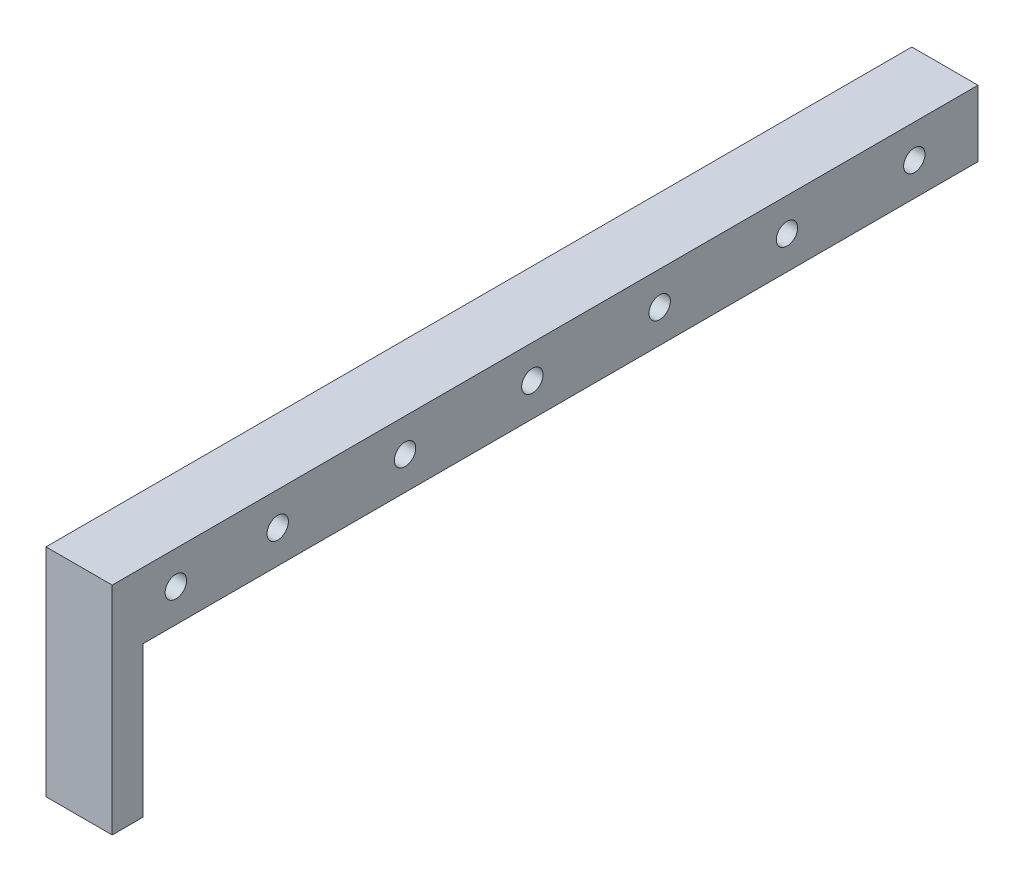
from build123d import *

# Parameters (mm, degrees)
SKETCH1_W           = 13
SKETCH1_H           = 13
BOSS_EXTRUDE1_DEPTH = 85
SKETCH2_W           = 13
SKETCH2_H           = 30.5
BOSS_EXTRUDE2_DEPTH = 3
SKETCH3_R           = 2.1
CUT_EXTRUDE1_DEPTH  = 11.5
SKETCH4_R           = 5.25
CUT_EXTRUDE2_DEPTH  = 4.5


with BuildPart() as part:
    # Sketch1 → Boss-Extrude1 (new, symmetric)
    with BuildSketch(Plane.XY):
        Rectangle(SKETCH1_W, SKETCH1_H)
    extrude(amount=BOSS_EXTRUDE1_DEPTH, both=True)

    # Sketch2 → Boss-Extrude2 (add, symmetric)
    with BuildSketch(Plane.XY.offset(82)):
        with Locations((0, -20.75)):
            Rectangle(SKETCH2_W, SKETCH2_H)
    extrude(amount=BOSS_EXTRUDE2_DEPTH, both=True)

    # Sketch3 → Cut-Extrude1 (cut, symmetric)
    with BuildSketch(Plane(origin=(0, 0, 0), x_dir=(0, 0, -1), z_dir=(1, 0, 0))):
        with Locations((72.5, 0)):
            Circle(SKETCH3_R)
        with Locations((47.5, 0)):
            Circle(SKETCH3_R)
        with Locations((22.5, 0)):
            Circle(SKETCH3_R)
        with Locations((-2.5, 0)):
            Circle(SKETCH3_R)
        with Locations((-27.5, 0)):
            Circle(SKETCH3_R)
        with Locations((-52.5, 0)):
            Circle(SKETCH3_R)
        with Locations((-72.5, 0)):
            Circle(SKETCH3_R)
    extrude(amount=CUT_EXTRUDE1_DEPTH, both=True, mode=Mode.SUBTRACT)

    # Sketch4 → Cut-Extrude2 (cut, symmetric)
    with BuildSketch(Plane(origin=(-6.5, 0, 0), x_dir=(0, 0, -1), z_dir=(1, 0, 0))):
        with Locations((72.5, 0)):
            Circle(SKETCH4_R)
        with Locations((47.5, 0)):
            Circle(SKETCH4_R)
        with Locations((22.5, 0)):
            Circle(SKETCH4_R)
        with Locations((-2.5, 0)):
            Circle(SKETCH4_R)
        with Locations((-27.5, 0)):
            Circle(SKETCH4_R)
        with Locations((-52.5, 0)):
            Circle(SKETCH4_R)
        with Locations((-72.5, 0)):
            Circle(SKETCH4_R)
    extrude(amount=CUT_EXTRUDE2_DEPTH, both=True, mode=Mode.SUBTRACT)


solid = part.part
